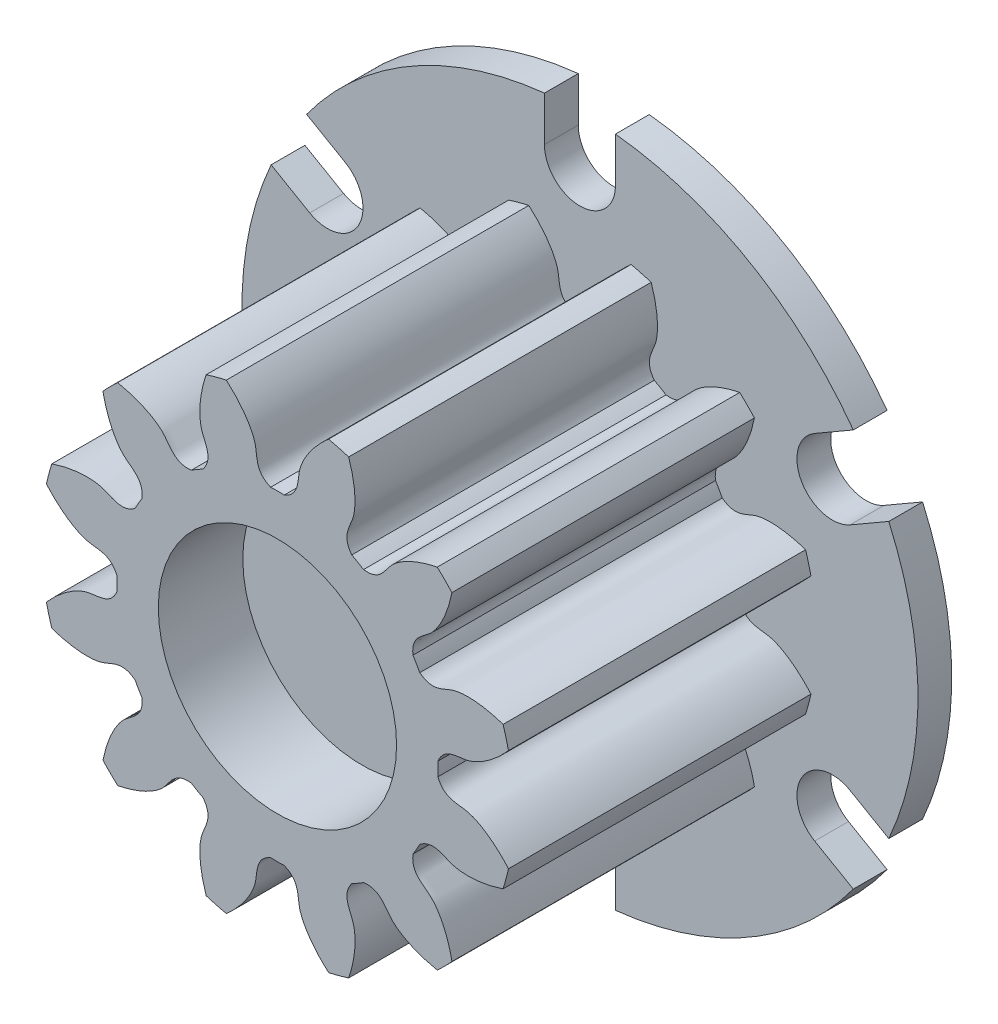
from build123d import *

# Parameters (mm, degrees)
SKETCH_1_R               = 14
EXTRUDE_1_DEPTH          = 17.9
CUT_EXTRUDE_1_DEPTH      = 27.691009722
PATTERN_CIRCULAR_1_COUNT = 12
SKETCH_4_R               = 7.5
EXTRUDE_2_DEPTH          = 2
SKETCH_6_R               = 7.05
CUT_EXTRUDE_2_DEPTH      = 5
EXTRUDE_5_DEPTH          = 2


with BuildPart() as part:
    # 草图1 → 凸台-拉伸1 (new body)
    with BuildSketch(Plane.XY):
        Circle(SKETCH_1_R)
    extrude(amount=EXTRUDE_1_DEPTH)

    # 草图2 → 切除-拉伸1 (cut, through all)
    with BuildSketch(Plane.XY):
        with BuildLine():
            ThreePointArc((0.401680225, 9.491504254), (0, 9.5), (-0.401680225, 9.491504254))
            add(Edge.make_bspline(
                [(-0.401680225, 9.491504254), (-1.361577738, 9.898614926), (-1.148746958, 10.689637365), (-1.352304376, 11.378961155), (-1.365247708, 11.419811475), (-1.380454501, 11.46466685), (-1.398085738, 11.513452175), (-1.41830525, 11.566086477), (-1.441273032, 11.622484138), (-1.467147122, 11.682554592), (-1.496082862, 11.746202504), (-1.528232954, 11.813327799), (-1.563747275, 11.883825742), (-1.602772771, 11.957587012), (-1.645453327, 12.034497774), (-1.691929648, 12.114439762), (-1.742339142, 12.197290357), (-1.796815797, 12.282922678), (-1.855490069, 12.371205667), (-1.918488769, 12.462004178), (-1.985934952, 12.555179076), (-2.057947808, 12.650587329), (-2.134642556, 12.748082111), (-2.216130341, 12.847512903), (-2.302518131, 12.948725598), (-2.39390862, 13.051562605), (-2.490400133, 13.155862967), (-2.59208653, 13.261462464), (-2.699057115, 13.368193734), (-2.811396554, 13.475886387), (-2.929184784, 13.584367126), (-3.052496933, 13.693459866), (-3.181403243, 13.802985862), (-3.31596899, 13.912763828), (-3.456254416, 14.02261007), (-3.602314655, 14.132338614), (-3.754199671, 14.241761336), (-3.911954189, 14.350688096), (-4.07561764, 14.458926871), (-4.2452241, 14.566283893), (-4.420802241, 14.672563788), (-4.602375278, 14.77756971), (-4.789960922, 14.881103487), (-4.983571339, 14.98296576), (-5.183213107, 15.082956125), (-5.388887185, 15.18087328), (-5.600588875, 15.276515169), (-5.818307792, 15.369679124), (-6.042027853, 15.460162018), (-6.27172721, 15.547760413), (-6.588759411, 15.661455917), (-6.8311872, 15.740202816), (-6.995210805, 15.78994182)],
                knots=[0, 0, 0, 0, 0.218015236, 0.222043642, 0.226545979, 0.231522246, 0.236972443, 0.24289657, 0.249294627, 0.256166614, 0.263512532, 0.271332379, 0.279626157, 0.288393865, 0.297635503, 0.307351072, 0.31754057, 0.328203999, 0.339341357, 0.350952646, 0.363037866, 0.375597015, 0.388630094, 0.402137104, 0.416118043, 0.430572913, 0.445501713, 0.460904444, 0.476781104, 0.493131694, 0.509956215, 0.527254666, 0.545027047, 0.563273358, 0.581993599, 0.601187771, 0.620855872, 0.640997904, 0.661613866, 0.682703758, 0.704267581, 0.726305333, 0.748817015, 0.771802628, 0.795262171, 0.819195644, 0.843603047, 0.868484381, 0.893839644, 0.919668838, 0.945971962, 1, 1, 1, 1], degree=3))
            ThreePointArc((-6.995210805, 15.78994182), (0, 17.270067658), (6.995210805, 15.78994182))
            add(Edge.make_bspline(
                [(0.401680225, 9.491504254), (1.361577738, 9.898614926), (1.148746958, 10.689637365), (1.352304376, 11.378961155), (1.365247708, 11.419811475), (1.380454501, 11.46466685), (1.398085738, 11.513452175), (1.41830525, 11.566086477), (1.441273032, 11.622484138), (1.467147122, 11.682554592), (1.496082862, 11.746202504), (1.528232954, 11.813327799), (1.563747275, 11.883825742), (1.602772771, 11.957587012), (1.645453327, 12.034497774), (1.691929648, 12.114439762), (1.742339142, 12.197290357), (1.796815797, 12.282922678), (1.855490069, 12.371205667), (1.918488769, 12.462004178), (1.985934952, 12.555179076), (2.057947808, 12.650587329), (2.134642556, 12.748082111), (2.216130341, 12.847512903), (2.302518131, 12.948725598), (2.39390862, 13.051562605), (2.490400133, 13.155862967), (2.59208653, 13.261462464), (2.699057115, 13.368193734), (2.811396554, 13.475886387), (2.929184784, 13.584367126), (3.052496933, 13.693459866), (3.181403243, 13.802985862), (3.31596899, 13.912763828), (3.456254416, 14.02261007), (3.602314655, 14.132338614), (3.754199671, 14.241761336), (3.911954189, 14.350688096), (4.07561764, 14.458926871), (4.2452241, 14.566283893), (4.420802241, 14.672563788), (4.602375278, 14.77756971), (4.789960922, 14.881103487), (4.983571339, 14.98296576), (5.183213107, 15.082956125), (5.388887185, 15.18087328), (5.600588875, 15.276515169), (5.818307792, 15.369679124), (6.042027853, 15.460162018), (6.27172721, 15.547760413), (6.588759411, 15.661455917), (6.8311872, 15.740202816), (6.995210805, 15.78994182)],
                knots=[0, 0, 0, 0, 0.218015236, 0.222043642, 0.226545979, 0.231522246, 0.236972443, 0.24289657, 0.249294627, 0.256166614, 0.263512532, 0.271332379, 0.279626157, 0.288393865, 0.297635503, 0.307351072, 0.31754057, 0.328203999, 0.339341357, 0.350952646, 0.363037866, 0.375597015, 0.388630094, 0.402137104, 0.416118043, 0.430572913, 0.445501713, 0.460904444, 0.476781104, 0.493131694, 0.509956215, 0.527254666, 0.545027047, 0.563273358, 0.581993599, 0.601187771, 0.620855872, 0.640997904, 0.661613866, 0.682703758, 0.704267581, 0.726305333, 0.748817015, 0.771802628, 0.795262171, 0.819195644, 0.843603047, 0.868484381, 0.893839644, 0.919668838, 0.945971962, 1, 1, 1, 1], degree=3))
        make_face()
    cut_extrude_1 = extrude(amount=CUT_EXTRUDE_1_DEPTH, mode=Mode.SUBTRACT)

    # 阵列(圆周)1: 切除-拉伸1 ×12 about axis
    pattern_circular_1_axis = Axis((0, 0, -0.6), (0, 0, 1))
    for i in range(1, PATTERN_CIRCULAR_1_COUNT):
        add(cut_extrude_1.rotate(pattern_circular_1_axis, i * 360 / PATTERN_CIRCULAR_1_COUNT), mode=Mode.SUBTRACT)

    # 草图4 → 凸台-拉伸2 (add)
    with BuildSketch(Plane(origin=(0, 0, 0), x_dir=(-1, 0, 0), z_dir=(0, 0, -1))):
        Circle(SKETCH_4_R)
    extrude(amount=EXTRUDE_2_DEPTH)

    # 草图6 → 切除-拉伸2 (cut)
    with BuildSketch(Plane.XY.offset(17.9)):
        Circle(SKETCH_6_R)
    extrude(amount=-CUT_EXTRUDE_2_DEPTH, mode=Mode.SUBTRACT)

    # 草图8 → 凸台-拉伸5 (add)
    with BuildSketch(Plane(origin=(0, 0, 0), x_dir=(-1, 0, 0), z_dir=(0, 0, -1))):
        with BuildLine():
            ThreePointArc((2.1, 17.25), (0, 15.15), (-2.1, 17.25))
            Line((-2.1, 17.25), (-2.1, 19.889444437))
            ThreePointArc((-2.1, 19.889444437), (-10, 17.320508076), (-16.174764149, 11.763375566))
            Line((-16.174764149, 11.763375566), (-13.888938215, 10.443653348))
            ThreePointArc((-13.888938215, 10.443653348), (-13.120284867, 9.675), (-12.838938215, 8.625))
            ThreePointArc((-12.838938215, 8.625), (-13.888938215, 6.806346652), (-15.988938215, 6.806346652))
            Line((-15.988938215, 6.806346652), (-18.274764149, 8.12606887))
            ThreePointArc((-18.274764149, 8.12606887), (-20, 0), (-18.274764149, -8.12606887))
            Line((-18.274764149, -8.12606887), (-15.988938215, -6.806346652))
            ThreePointArc((-15.988938215, -6.806346652), (-13.888938215, -6.806346652), (-12.838938215, -8.625))
            ThreePointArc((-12.838938215, -8.625), (-13.120284867, -9.675), (-13.888938215, -10.443653348))
            Line((-13.888938215, -10.443653348), (-16.174764149, -11.763375566))
            ThreePointArc((-16.174764149, -11.763375566), (-10, -17.320508076), (-2.1, -19.889444437))
            Line((-2.1, -19.889444437), (-2.1, -17.25))
            ThreePointArc((-2.1, -17.25), (0, -15.15), (2.1, -17.25))
            Line((2.1, -17.25), (2.1, -19.889444437))
            ThreePointArc((2.1, -19.889444437), (10, -17.320508076), (16.174764149, -11.763375566))
            Line((16.174764149, -11.763375566), (13.888938215, -10.443653348))
            ThreePointArc((13.888938215, -10.443653348), (13.120284867, -7.575), (15.988938215, -6.806346652))
            Line((15.988938215, -6.806346652), (18.274764149, -8.12606887))
            ThreePointArc((18.274764149, -8.12606887), (19.56393727, -4.153595853), (20, 0))
            ThreePointArc((20, 0), (19.56393727, 4.153595853), (18.274764149, 8.12606887))
            Line((18.274764149, 8.12606887), (15.988938215, 6.806346652))
            ThreePointArc((15.988938215, 6.806346652), (13.120284867, 7.575), (13.888938215, 10.443653348))
            Line((13.888938215, 10.443653348), (16.174764149, 11.763375566))
            ThreePointArc((16.174764149, 11.763375566), (10, 17.320508076), (2.1, 19.889444437))
            Line((2.1, 19.889444437), (2.1, 17.25))
        make_face()
    extrude(amount=EXTRUDE_5_DEPTH)


solid = part.part
